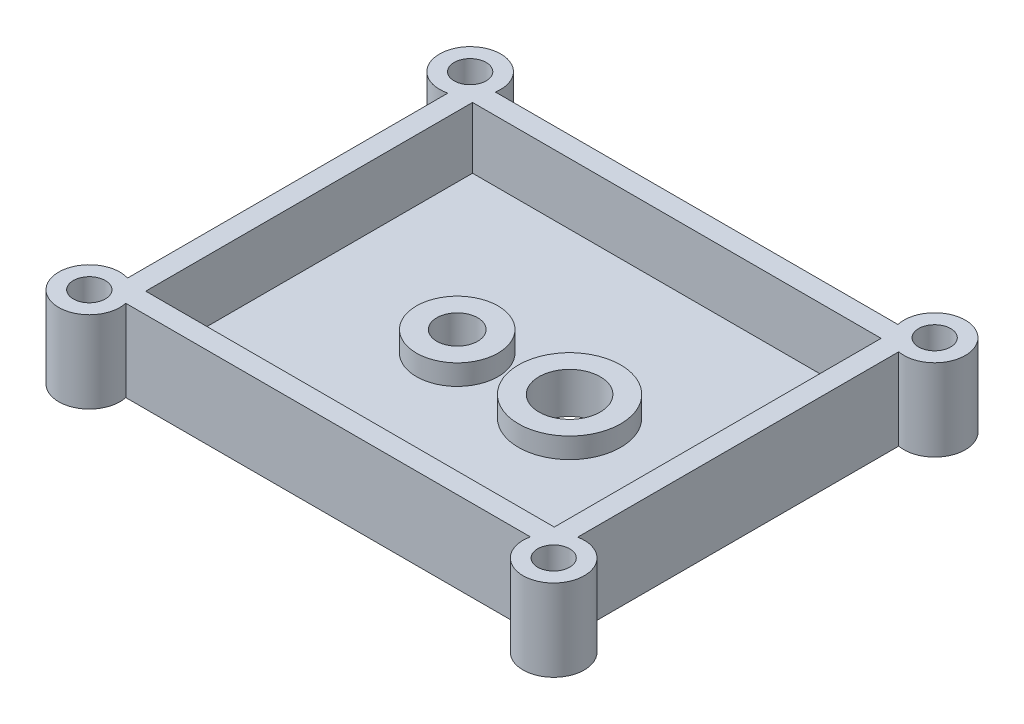
from build123d import *

# Parameters (mm, degrees)
SKETCH1_W           = 69.85
SKETCH1_H           = 57.15
BOSS_EXTRUDE1_DEPTH = 12.7
SKETCH2_W           = 63.5
SKETCH2_H           = 50.8
CUT_EXTRUDE1_DEPTH  = 9.525
SKETCH3_R           = 6.35
SKETCH3_R_2         = 3.175
SKETCH3_R_3         = 7.9375
SKETCH3_R_4         = 4.7625
BOSS_EXTRUDE2_DEPTH = 3.175
SKETCH5_R           = 3.175
CUT_EXTRUDE2_DEPTH  = 46.5698228
SKETCH6_R           = 4.7625
CUT_EXTRUDE3_DEPTH  = 46.5698228
SKETCH8_R           = 4.7625
BOSS_EXTRUDE3_DEPTH = 12.7
SKETCH9_R           = 2.4892
CUT_EXTRUDE4_DEPTH  = 56.068582541


with BuildPart() as part:
    # Sketch1 → Boss-Extrude1 (new body)
    with BuildSketch(Plane(origin=(0, 0, 0), x_dir=(1, 0, 0), z_dir=(0, 1, 0))):
        Rectangle(SKETCH1_W, SKETCH1_H)
    extrude(amount=BOSS_EXTRUDE1_DEPTH)

    # Sketch2 → Cut-Extrude1 (cut)
    with BuildSketch(Plane(origin=(0, 12.7, 0), x_dir=(1, 0, 0), z_dir=(0, 1, 0))):
        Rectangle(SKETCH2_W, SKETCH2_H)
    extrude(amount=-CUT_EXTRUDE1_DEPTH, mode=Mode.SUBTRACT)

    # Sketch3 → Boss-Extrude2 (add)
    # profile 1 of 2: a face of its own
    with BuildSketch(Plane(origin=(0, 3.175, 0), x_dir=(1, 0, 0), z_dir=(0, 1, 0))):
        with Locations(Location((-8.73125, 0, 0), (0, 0, 90))):
            Circle(SKETCH3_R)
        with Locations(Location((-8.73125, 0, 0), (0, 0, 270))):
            Circle(SKETCH3_R_2, mode=Mode.SUBTRACT)
    # profile 2 of 2: a face of its own
    with BuildSketch(Plane(origin=(0, 3.175, 0), x_dir=(1, 0, 0), z_dir=(0, 1, 0))):
        with Locations(Location((8.73125, 0, 0), (0, 0, 90))):
            Circle(SKETCH3_R_3)
        with Locations(Location((8.73125, 0, 0), (0, 0, 270))):
            Circle(SKETCH3_R_4, mode=Mode.SUBTRACT)
    extrude(amount=BOSS_EXTRUDE2_DEPTH)

    # Sketch5 → Cut-Extrude2 (cut, through all)
    with BuildSketch(Plane(origin=(0, 6.35, 0), x_dir=(1, 0, 0), z_dir=(0, 1, 0))):
        with Locations(Location((-8.73125, 0, 0), (0, 0, 270))):
            Circle(SKETCH5_R)
    extrude(amount=-CUT_EXTRUDE2_DEPTH, mode=Mode.SUBTRACT)

    # Sketch6 → Cut-Extrude3 (cut, through all)
    with BuildSketch(Plane(origin=(0, 6.35, 0), x_dir=(1, 0, 0), z_dir=(0, 1, 0))):
        with Locations(Location((8.73125, 0, 0), (0, 0, 270))):
            Circle(SKETCH6_R)
    extrude(amount=-CUT_EXTRUDE3_DEPTH, mode=Mode.SUBTRACT)

    # Sketch8 → Boss-Extrude3 (add)
    with BuildSketch(Plane(origin=(0, 12.7, 0), x_dir=(1, 0, 0), z_dir=(0, 1, 0))):
        with Locations((-36.080944449, 29.359475258)):
            Circle(SKETCH8_R)
        with Locations((35.832665303, 29.636957013)):
            Circle(SKETCH8_R)
        with Locations((35.864779118, -29.608646076)):
            Circle(SKETCH8_R)
        with Locations((-36.322, -29.590559194)):
            Circle(SKETCH8_R)
    extrude(amount=-BOSS_EXTRUDE3_DEPTH)

    # Sketch9 → Cut-Extrude4 (cut, through all)
    with BuildSketch(Plane(origin=(0, 12.7, 0), x_dir=(1, 0, 0), z_dir=(0, 1, 0))):
        with Locations(Location((-36.080944449, 29.359475258, 0), (0, 0, 270))):
            Circle(SKETCH9_R)
        with Locations(Location((-36.322, -29.590559194, 0), (0, 0, 270))):
            Circle(SKETCH9_R)
        with Locations(Location((35.864779118, -29.608646076, 0), (0, 0, 270))):
            Circle(SKETCH9_R)
        with Locations(Location((35.832665303, 29.636957013, 0), (0, 0, 270))):
            Circle(SKETCH9_R)
    extrude(amount=-CUT_EXTRUDE4_DEPTH, mode=Mode.SUBTRACT)


solid = part.part
